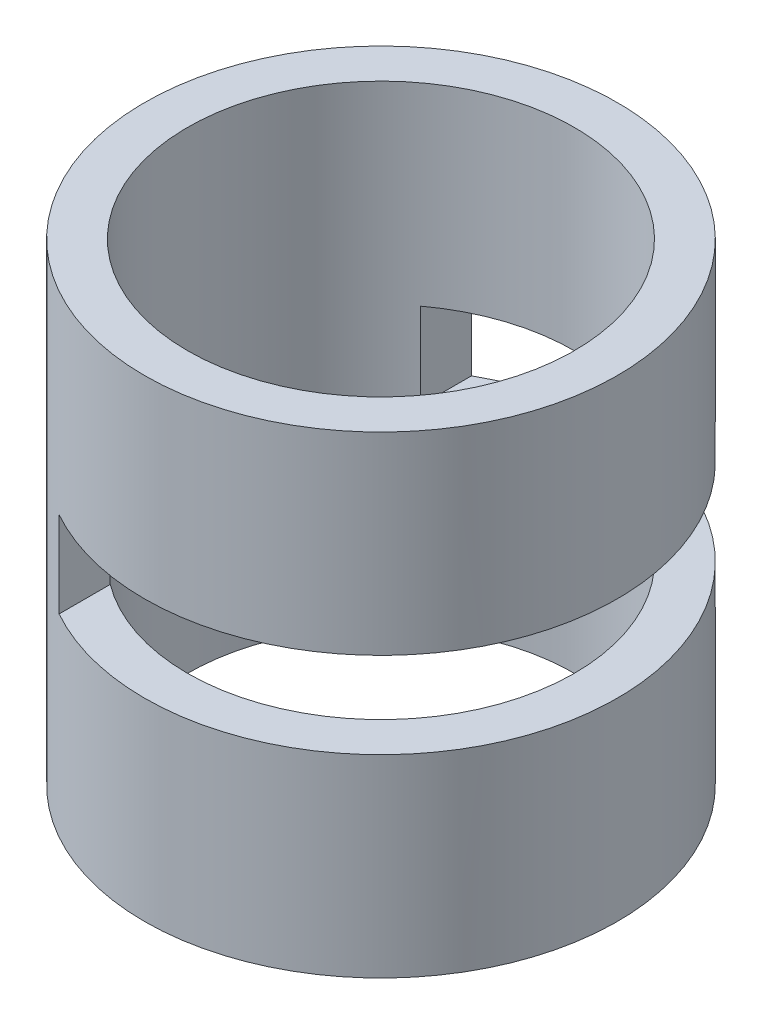
from build123d import *

# Parameters (mm, degrees)
SKETCH_1_W               = 2
SKETCH_1_H               = 22
CUT_EXTRUDE_1_DEPTH      = 27.944387171
CUT_EXTRUDE_1_DEPTH_BACK = 27.944387171
SKETCH_2_W               = 17
SKETCH_2_H               = 4


with BuildPart() as part:
    # 草图1 → 旋转1 (revolve)
    with BuildSketch(Plane.XY, mode=Mode.PRIVATE) as revolve_1_sk:
        with Locations((10, 11)):
            Rectangle(SKETCH_1_W, SKETCH_1_H)
    revolve(revolve_1_sk.sketch.rotate(Axis((0, 25.51049322, 0), (0, -1, 0)), 90), axis=Axis((0, 25.51049322, 0), (0, -1, 0)))

    # 草图2 → 切除-拉伸1 (cut, two sides: drawn at the far end of the back side and taken through both)
    with BuildSketch(Plane.XY.offset(-CUT_EXTRUDE_1_DEPTH_BACK)):
        with Locations((3.12, 11)):
            Rectangle(SKETCH_2_W, SKETCH_2_H)
    extrude(amount=CUT_EXTRUDE_1_DEPTH + CUT_EXTRUDE_1_DEPTH_BACK, mode=Mode.SUBTRACT)


solid = part.part
